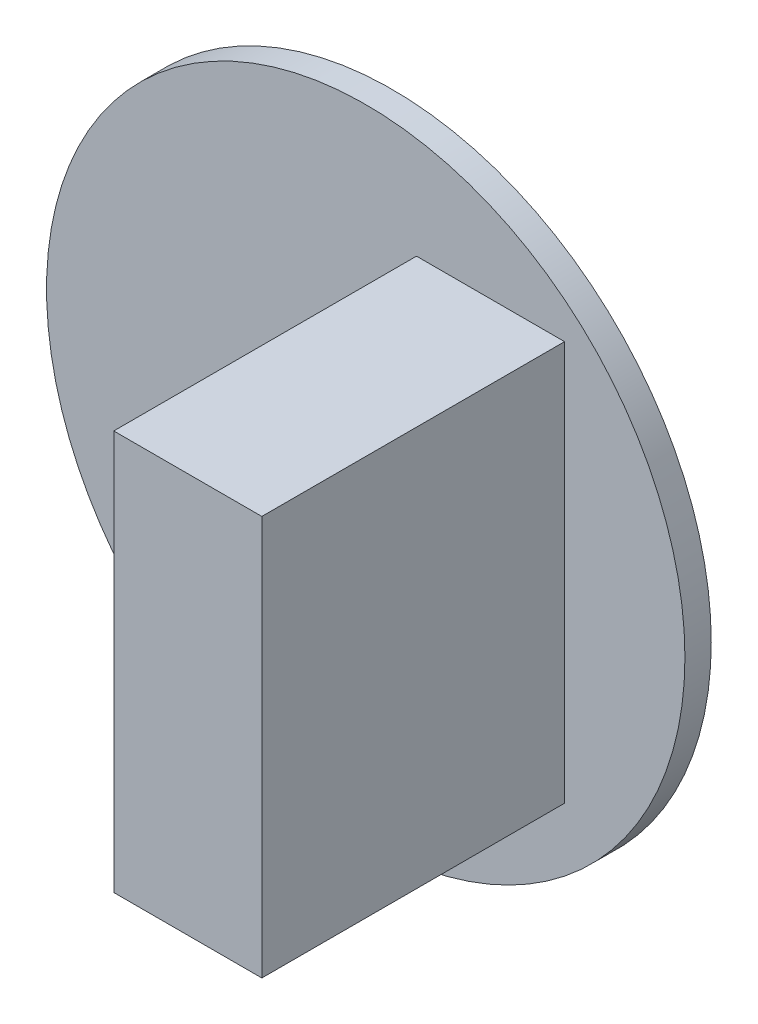
from build123d import *

# Parameters (mm, degrees)
SKETCH1_R           = 48.5
BOSS_EXTRUDE1_DEPTH = 4
SKETCH3_W           = 22.5
SKETCH3_H           = 60.737617489
BOSS_EXTRUDE2_DEPTH = 50


with BuildPart() as part:
    # Sketch1 → Boss-Extrude1 (new body)
    with BuildSketch(Plane.XY):
        Circle(SKETCH1_R)
    extrude(amount=BOSS_EXTRUDE1_DEPTH)

    # Sketch3 → Boss-Extrude2 (add)
    with BuildSketch(Plane.XY):
        with Locations((18.96056614, 2.029096352)):
            Rectangle(SKETCH3_W, SKETCH3_H)
    extrude(amount=BOSS_EXTRUDE2_DEPTH)


solid = part.part
